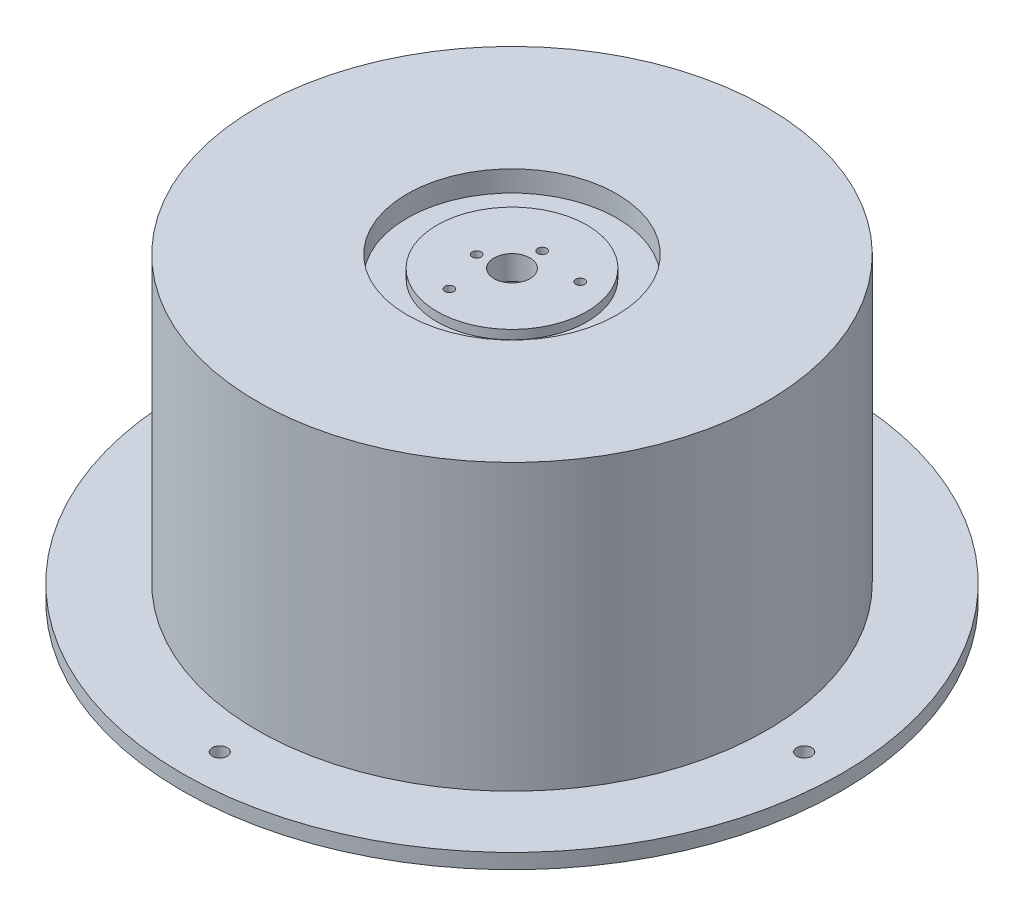
from build123d import *

# Parameters (mm, degrees)
CUT_EXTRUDE1_REACH  = 155.838
SKETCH2_R           = 1.5
SKETCH3_R           = 110
SKETCH3_R_2         = 85
SKETCH3_R_3         = 2.5
BOSS_EXTRUDE1_DEPTH = 5


with BuildPart() as part:
    # Sketch1 → Revolve1 (revolve)
    with BuildSketch(Plane.XY, mode=Mode.PRIVATE) as revolve1_sk:
        Polygon((80, 0), (80, 88), (6, 88), (6, 96), (25, 96), (25, 93), (35, 93), (35, 100), (85, 100), (85, 0), align=None)
    revolve(revolve1_sk.sketch.rotate(Axis((0, 0, 0), (0, 1, 0)), 90), axis=Axis((0, 0, 0), (0, 1, 0)))

    # Sketch2 → Cut-Extrude1 (cut, up to next)
    with BuildSketch(Plane(origin=(0, 96, 0), x_dir=(1, 0, 0), z_dir=(0, 1, 0)), mode=Mode.PRIVATE) as cut_extrude1_sk1:
        with Locations(Location((0, 10.052527236, 0), (0, 0, 270))):
            Circle(SKETCH2_R)
    cut_extrude1_tool1 = extrude(cut_extrude1_sk1.sketch, amount=-CUT_EXTRUDE1_REACH, mode=Mode.PRIVATE) & part.part
    # Sketch2 → Cut-Extrude1 (cut, up to next)
    with BuildSketch(Plane(origin=(0, 96, 0), x_dir=(1, 0, 0), z_dir=(0, 1, 0)), mode=Mode.PRIVATE) as cut_extrude1_sk2:
        with Locations(Location((-9.888059839, -1.883815278, 0), (0, 0, 270))):
            Circle(SKETCH2_R)
    cut_extrude1_tool2 = extrude(cut_extrude1_sk2.sketch, amount=-CUT_EXTRUDE1_REACH, mode=Mode.PRIVATE) & part.part
    # Sketch2 → Cut-Extrude1 (cut, up to next)
    with BuildSketch(Plane(origin=(0, 96, 0), x_dir=(1, 0, 0), z_dir=(0, 1, 0)), mode=Mode.PRIVATE) as cut_extrude1_sk3:
        with Locations(Location((-4.4752587, -16.407987676, 0), (0, 0, 270))):
            Circle(SKETCH2_R)
    cut_extrude1_tool3 = extrude(cut_extrude1_sk3.sketch, amount=-CUT_EXTRUDE1_REACH, mode=Mode.PRIVATE) & part.part
    # Sketch2 → Cut-Extrude1 (cut, up to next)
    with BuildSketch(Plane(origin=(0, 96, 0), x_dir=(1, 0, 0), z_dir=(0, 1, 0)), mode=Mode.PRIVATE) as cut_extrude1_sk4:
        with Locations(Location((15.268544691, 7.491431306, 0), (0, 0, 270))):
            Circle(SKETCH2_R)
    cut_extrude1_tool4 = extrude(cut_extrude1_sk4.sketch, amount=-CUT_EXTRUDE1_REACH, mode=Mode.PRIVATE) & part.part
    add(cut_extrude1_tool1.solids().sort_by_distance((0, 96, -10.052527))[0], mode=Mode.SUBTRACT)
    add(cut_extrude1_tool2.solids().sort_by_distance((-9.88806, 96, 1.883815))[0], mode=Mode.SUBTRACT)
    add(cut_extrude1_tool3.solids().sort_by_distance((-4.475259, 96, 16.407988))[0], mode=Mode.SUBTRACT)
    add(cut_extrude1_tool4.solids().sort_by_distance((15.268545, 96, -7.491431))[0], mode=Mode.SUBTRACT)

    # Sketch3 → Boss-Extrude1 (add)
    with BuildSketch(Plane.XZ):
        with Locations(Location((0, 0, 0), (0, 0, 270))):
            Circle(SKETCH3_R)
        with Locations(Location((0, 0, 0), (0, 0, 270))):
            Circle(SKETCH3_R_2, mode=Mode.SUBTRACT)
        with Locations(Location((0, 97.5, 0), (0, 0, 270))):
            Circle(SKETCH3_R_3, mode=Mode.SUBTRACT)
        with Locations(Location((97.5, 0, 0), (0, 0, 270))):
            Circle(SKETCH3_R_3, mode=Mode.SUBTRACT)
        with Locations(Location((0, -97.5, 0), (0, 0, 270))):
            Circle(SKETCH3_R_3, mode=Mode.SUBTRACT)
        with Locations(Location((-97.5, 0, 0), (0, 0, 270))):
            Circle(SKETCH3_R_3, mode=Mode.SUBTRACT)
    extrude(amount=-BOSS_EXTRUDE1_DEPTH)


solid = part.part
